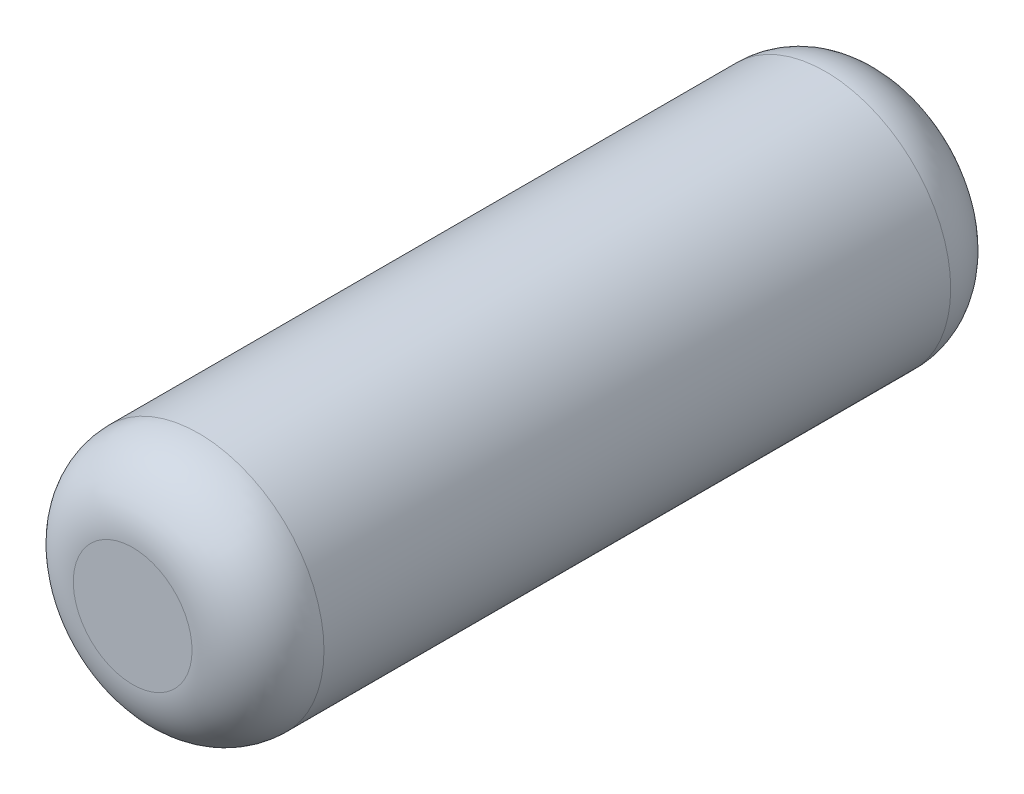
from build123d import *

# Parameters (mm, degrees)
SKETCH1_R           = 48.26
BOSS_EXTRUDE1_DEPTH = 292.1
FILLET1_R           = 25.4


with BuildPart() as part:
    # Sketch1 → Boss-Extrude1 (new body)
    with BuildSketch(Plane.XY):
        Circle(SKETCH1_R)
    extrude(amount=BOSS_EXTRUDE1_DEPTH)

    # Fillet1
    fillet1_edges = [part.edges().sort_by_distance(p)[0] for p in [
        (-48.26, 0, 0),
        (-48.26, 0, 292.1),
    ]]
    fillet(fillet1_edges, radius=FILLET1_R)


solid = part.part
